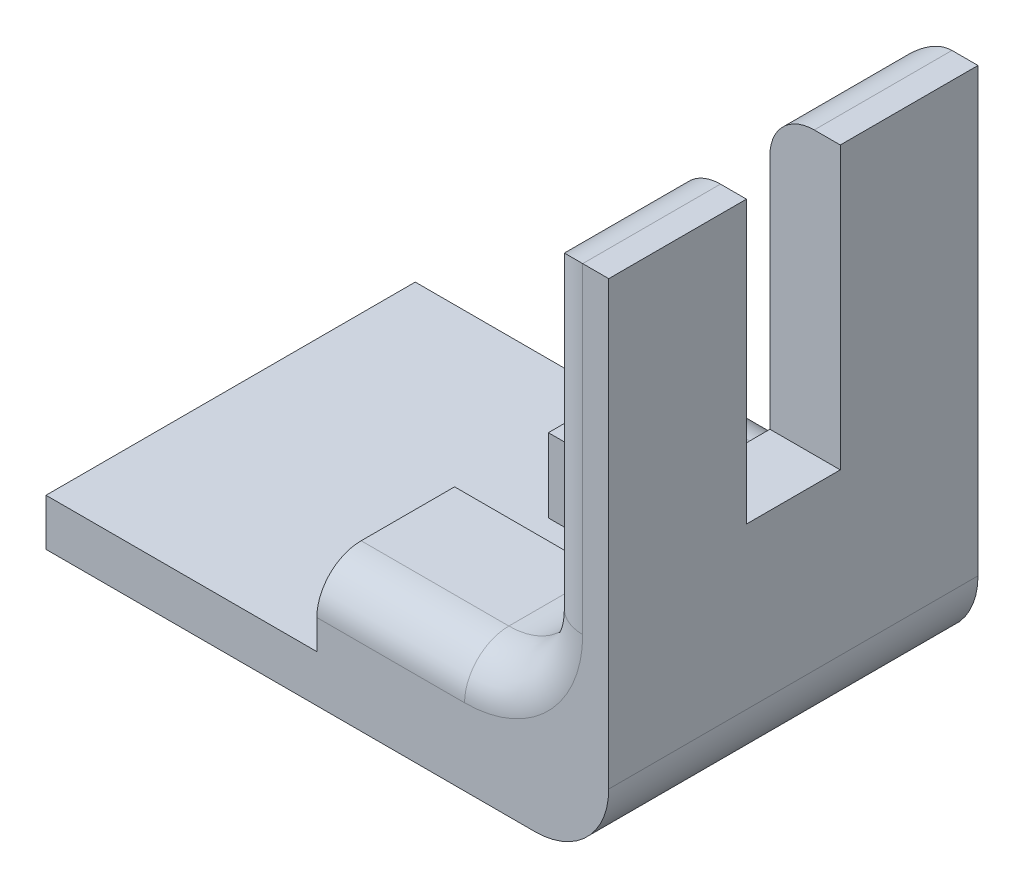
from build123d import *

# Parameters (mm, degrees)
SKETCH1_W           = 76.2
SKETCH1_H           = 50
BOSS_EXTRUDE1_DEPTH = 6.35
SKETCH2_W           = 9.525
SKETCH2_H           = 50
BOSS_EXTRUDE2_DEPTH = 63.5
SKETCH3_W           = 12.7
SKETCH3_H           = 38.1
CUT_EXTRUDE1_DEPTH  = 63.5
SKETCH4_W           = 30
SKETCH4_H           = 50
BOSS_EXTRUDE3_DEPTH = 10
SKETCH5_W           = 30
SKETCH5_H           = 12.7
CUT_EXTRUDE2_DEPTH  = 10
FILLET2_R           = 10
FILLET3_R           = 6
FILLET4_R           = 10


with BuildPart() as part:
    # Sketch1 → Boss-Extrude1 (new body)
    with BuildSketch(Plane(origin=(0, 0, 0), x_dir=(1, 0, 0), z_dir=(0, 1, 0))):
        with Locations((-17.435704212, -13.54987632)):
            Rectangle(SKETCH1_W, SKETCH1_H)
    extrude(amount=BOSS_EXTRUDE1_DEPTH)

    # Sketch2 → Boss-Extrude2 (add)
    with BuildSketch(Plane(origin=(0, 6.35, 0), x_dir=(1, 0, 0), z_dir=(0, 1, 0))):
        with Locations((15.901795788, -13.54987632)):
            Rectangle(SKETCH2_W, SKETCH2_H)
    extrude(amount=BOSS_EXTRUDE2_DEPTH)

    # Sketch3 → Cut-Extrude1 (cut)
    with BuildSketch(Plane.ZY.offset(-11.139295788)):
        with Locations((13.54987632, 50.8)):
            Rectangle(SKETCH3_W, SKETCH3_H)
    extrude(amount=-CUT_EXTRUDE1_DEPTH, mode=Mode.SUBTRACT)

    # Sketch4 → Boss-Extrude3 (add)
    with BuildSketch(Plane(origin=(0, 6.35, 0), x_dir=(1, 0, 0), z_dir=(0, 1, 0))):
        with Locations((-3.860704212, -13.54987632)):
            Rectangle(SKETCH4_W, SKETCH4_H)
    extrude(amount=BOSS_EXTRUDE3_DEPTH)

    # Sketch5 → Cut-Extrude2 (cut)
    with BuildSketch(Plane(origin=(0, 16.35, 0), x_dir=(1, 0, 0), z_dir=(0, 1, 0))):
        with Locations((-3.860704212, -13.54987632)):
            Rectangle(SKETCH5_W, SKETCH5_H)
    extrude(amount=-CUT_EXTRUDE2_DEPTH, mode=Mode.SUBTRACT)

    # Fillet2
    fillet2_edges = [part.edges().sort_by_distance(p)[0] for p in [
        (11.139295788, 16.35, 29.22487632),
        (11.139295788, 16.35, -2.12512368),
    ]]
    fillet(fillet2_edges, radius=FILLET2_R)

    # Fillet3
    fillet3_edges = [part.edges().sort_by_distance(p)[0] for p in [
        (11.139295788, 48.1, -11.45012368),
        (11.139295788, 48.1, 38.54987632),
        (11.139295788, 69.85, -2.12512368),
        (11.139295788, 69.85, 29.22487632),
        (-8.860704212, 16.35, 38.54987632),
        (-8.860704212, 16.35, -11.45012368),
        (8.210363599, 19.278932188, -11.45012368),
        (8.210363599, 19.278932188, 38.54987632),
    ]]
    fillet(fillet3_edges, radius=FILLET3_R)

    # Fillet4
    fillet4_edges = [part.edges().sort_by_distance(p)[0] for p in [
        (20.664295788, 0, 13.54987632),
    ]]
    fillet(fillet4_edges, radius=FILLET4_R)


solid = part.part
